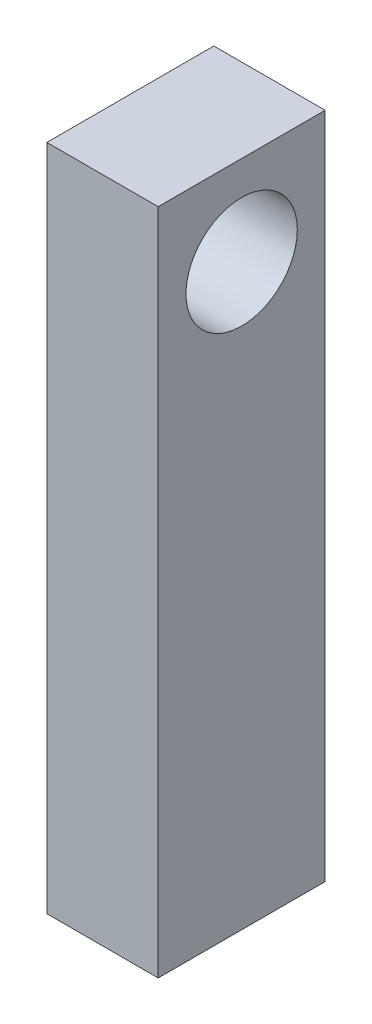
from build123d import *

# Parameters (mm, degrees)
CROQUIS1_W              = 30
CROQUIS1_H              = 120
CROQUIS1_R              = 10
SALIENTE_EXTRUIR1_DEPTH = 20


with BuildPart() as part:
    # Croquis1 → Saliente-Extruir1 (new body)
    with BuildSketch(Plane(origin=(0, 0, 0), x_dir=(0, 0, -1), z_dir=(1, 0, 0))):
        Rectangle(CROQUIS1_W, CROQUIS1_H)
        with Locations((0, 43.93083587)):
            Circle(CROQUIS1_R, mode=Mode.SUBTRACT)
    extrude(amount=SALIENTE_EXTRUIR1_DEPTH)


solid = part.part
